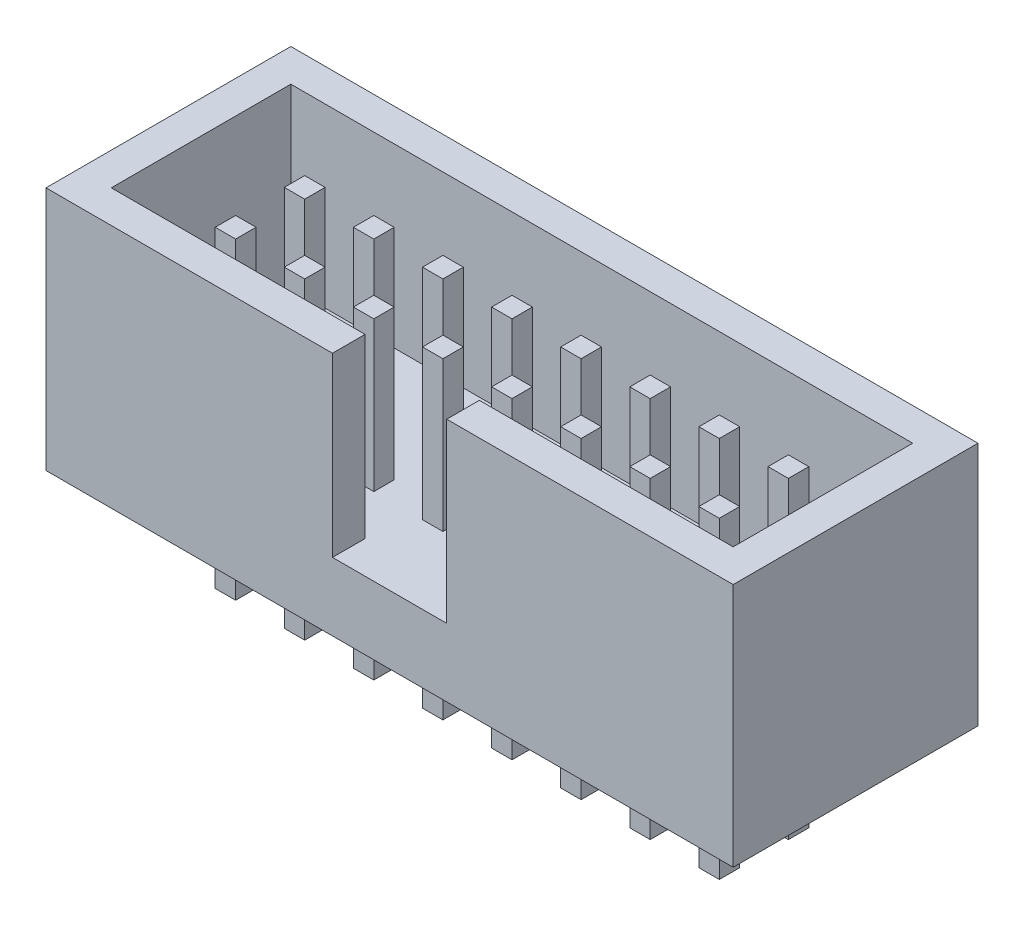
from build123d import *

# Parameters (mm, degrees)
SKETCH_1_W           = 25.26
SKETCH_1_H           = 9
EXTRUDE_1_DEPTH      = 9
SKETCH_2_W           = 22.86
SKETCH_2_H           = 6.6
CUT_EXTRUDE_1_DEPTH  = 6.5
SKETCH_3_W           = 4.2
SKETCH_3_H           = 6.5
CUT_EXTRUDE_2_DEPTH  = 6.5
EXTRUDE_2_DEPTH      = 3.5
EXTRUDE_2_DEPTH_BACK = 8
SKETCH_5_W           = 0.75
SKETCH_5_H           = 0.75


with BuildPart() as part:
    # 草图1 → 拉伸1 (new body)
    with BuildSketch(Plane(origin=(0, 0, 0), x_dir=(1, 0, 0), z_dir=(0, 1, 0))):
        Rectangle(SKETCH_1_W, SKETCH_1_H)
    extrude(amount=EXTRUDE_1_DEPTH)

    # 草图2 → 切除-拉伸1 (cut)
    with BuildSketch(Plane(origin=(0, 9, 0), x_dir=(-1, 0, 0), z_dir=(0, 1, 0))):
        Rectangle(SKETCH_2_W, SKETCH_2_H)
    extrude(amount=-CUT_EXTRUDE_1_DEPTH, mode=Mode.SUBTRACT)

    # 草图3 → 切除-拉伸2 (cut)
    with BuildSketch(Plane.XY.offset(4.5)):
        with Locations((0, 5.75)):
            Rectangle(SKETCH_3_W, SKETCH_3_H)
    extrude(amount=-CUT_EXTRUDE_2_DEPTH, mode=Mode.SUBTRACT)

    # 草图5 → 拉伸2 (add, two sides: drawn at the far end of the back side and taken through both)
    with BuildSketch(Plane.XZ.offset(-EXTRUDE_2_DEPTH_BACK)):
        with Locations((-1.27, 1.27)):
            Rectangle(SKETCH_5_W, SKETCH_5_H)
        with Locations((-3.81, 1.27)):
            Rectangle(SKETCH_5_W, SKETCH_5_H)
        with Locations((-6.35, 1.27)):
            Rectangle(SKETCH_5_W, SKETCH_5_H)
        with Locations((-8.89, 1.27)):
            Rectangle(SKETCH_5_W, SKETCH_5_H)
        with Locations((-8.89, -1.27)):
            Rectangle(SKETCH_5_W, SKETCH_5_H)
        with Locations((-6.35, -1.27)):
            Rectangle(SKETCH_5_W, SKETCH_5_H)
        with Locations((-3.81, -1.27)):
            Rectangle(SKETCH_5_W, SKETCH_5_H)
        with Locations((-1.27, -1.27)):
            Rectangle(SKETCH_5_W, SKETCH_5_H)
        with Locations((1.27, -1.27)):
            Rectangle(SKETCH_5_W, SKETCH_5_H)
        with Locations((3.81, -1.27)):
            Rectangle(SKETCH_5_W, SKETCH_5_H)
        with Locations((6.35, -1.27)):
            Rectangle(SKETCH_5_W, SKETCH_5_H)
        with Locations((8.89, -1.27)):
            Rectangle(SKETCH_5_W, SKETCH_5_H)
        with Locations((8.89, 1.27)):
            Rectangle(SKETCH_5_W, SKETCH_5_H)
        with Locations((6.35, 1.27)):
            Rectangle(SKETCH_5_W, SKETCH_5_H)
        with Locations((3.81, 1.27)):
            Rectangle(SKETCH_5_W, SKETCH_5_H)
        with Locations((1.27, 1.27)):
            Rectangle(SKETCH_5_W, SKETCH_5_H)
    extrude(amount=EXTRUDE_2_DEPTH + EXTRUDE_2_DEPTH_BACK)


solid = part.part
